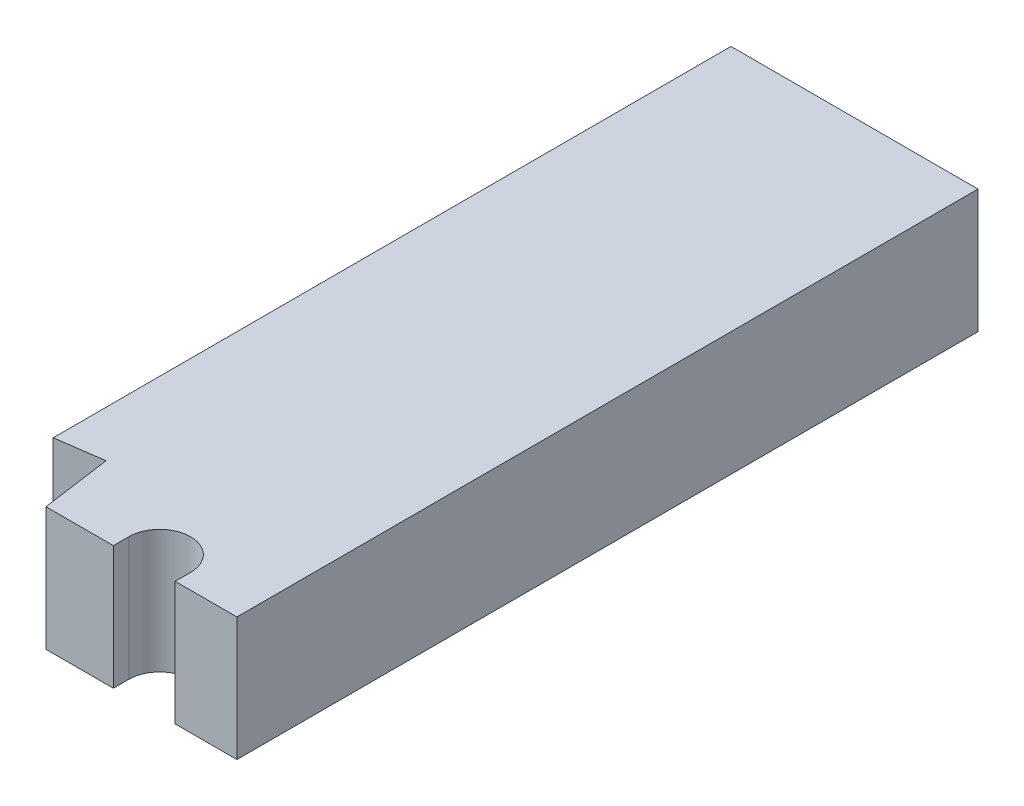
from build123d import *

# Parameters (mm, degrees)
SKETCH1_W               = 101.6
SKETCH1_H               = 50.8
BOSS_EXTRUDE1_DEPTH     = 304.8
CUT_EXTRUDE1_DEPTH      = 314.152231351
CUT_EXTRUDE1_DEPTH_BACK = 314.152231351


with BuildPart() as part:
    # Sketch1 → Boss-Extrude1 (new body)
    with BuildSketch(Plane.XY):
        Rectangle(SKETCH1_W, SKETCH1_H)
    extrude(amount=BOSS_EXTRUDE1_DEPTH)

    # Sketch2 → Cut-Extrude1 (cut, two sides: drawn at the far end of the back side and taken through both)
    with BuildSketch(Plane(origin=(0, 25.4, 0), x_dir=(1, 0, 0), z_dir=(0, 1, 0)).offset(-CUT_EXTRUDE1_DEPTH_BACK)):
        with BuildLine():
            ThreePointArc((25.4, -298.45), (12.7, -285.75), (0, -298.45))
            ThreePointArc((0, -298.45), (0.432742006, -301.737001873), (1.701477372, -304.8))
            Line((1.701477372, -304.8), (23.698522628, -304.8))
            ThreePointArc((23.698522628, -304.8), (24.967257994, -301.737001873), (25.4, -298.45))
        make_face()
        with BuildLine():
            Line((23.698522628, -304.8), (1.701477372, -304.8))
            ThreePointArc((1.701477372, -304.8), (12.7, -311.15), (23.698522628, -304.8))
        make_face()
        with BuildLine():
            Line((25.4, -304.8), (25.4, -298.45))
            ThreePointArc((25.4, -298.45), (24.967257994, -301.737001873), (23.698522628, -304.8))
            Line((23.698522628, -304.8), (25.4, -304.8))
        make_face()
        with BuildLine():
            Line((0, -298.45), (0, -304.8))
            Line((0, -304.8), (1.701477372, -304.8))
            ThreePointArc((1.701477372, -304.8), (0.432742006, -301.737001873), (0, -298.45))
        make_face()
        Polygon((-31.75, -276.0726), (-50.8, -278.749902901), (-50.8, -304.8), (-27.712627225, -304.8), align=None)
    extrude(amount=CUT_EXTRUDE1_DEPTH + CUT_EXTRUDE1_DEPTH_BACK, mode=Mode.SUBTRACT)


solid = part.part
